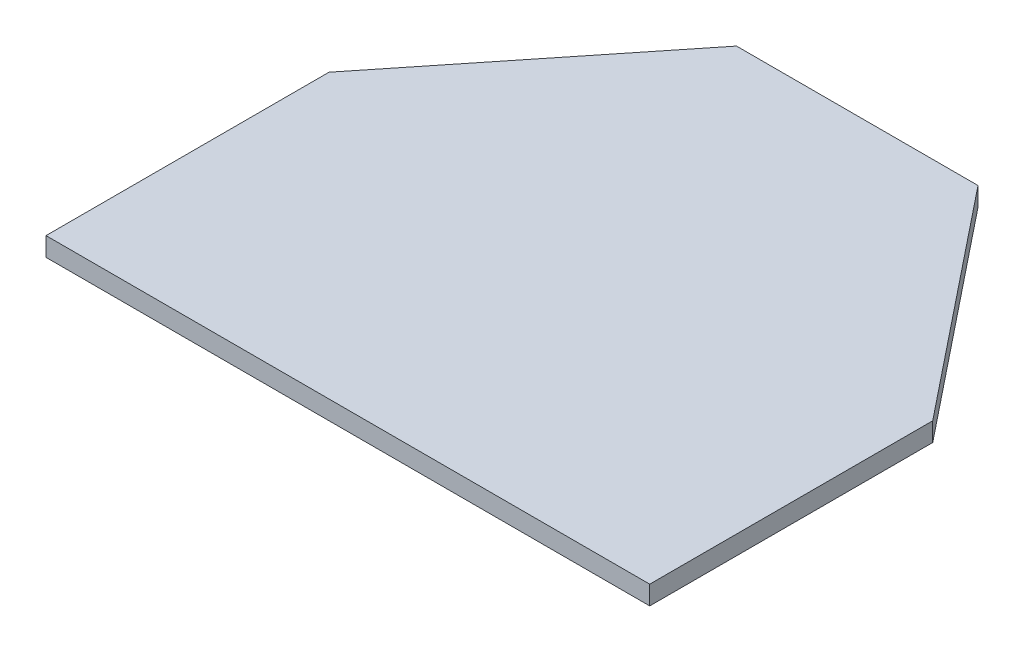
from build123d import *

# Parameters (mm, degrees)
BOSS_EXTRUDE1_DEPTH     = 2.5
CUT_EXTRUDE1_DEPTH      = 193.435053979
CUT_EXTRUDE1_DEPTH_BACK = 193.435053979
SKETCH2_W               = 350
SKETCH2_H               = 40


with BuildPart() as part:
    # Sketch1 → Boss-Extrude1 (new, symmetric)
    with BuildSketch(Plane(origin=(0, 0, 0), x_dir=(1, 0, 0), z_dir=(0, 1, 0))):
        Polygon((-80, 0), (80, 0), (80, 75), (0, 175), (-80, 75), align=None)
    extrude(amount=BOSS_EXTRUDE1_DEPTH, both=True)

    # Sketch2 → Cut-Extrude1 (cut, two sides: drawn at the far end of the back side and taken through both)
    with BuildSketch(Plane(origin=(0, 0, 0), x_dir=(1, 0, 0), z_dir=(0, 1, 0)).offset(-CUT_EXTRUDE1_DEPTH_BACK)):
        with Locations((0, 155)):
            Rectangle(SKETCH2_W, SKETCH2_H)
    extrude(amount=CUT_EXTRUDE1_DEPTH + CUT_EXTRUDE1_DEPTH_BACK, mode=Mode.SUBTRACT)


solid = part.part
